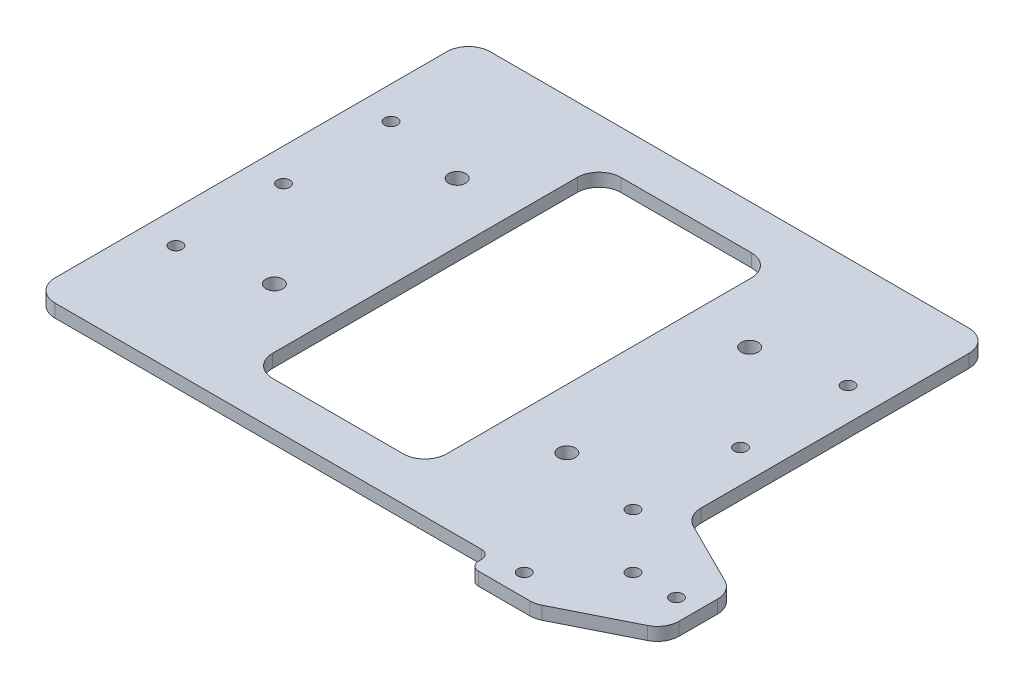
from build123d import *

# Parameters (mm, degrees)
SKETCH_1_R      = 1.95
SKETCH_1_R_2    = 1.45
SKETCH_1_W      = 40
SKETCH_1_H      = 80
EXTRUDE_1_DEPTH = 3
FILLET_1_R      = 5
FILLET_3_R      = 2


with BuildPart() as part:
    # 草图1 → 凸台-拉伸1 (new body)
    with BuildSketch(Plane(origin=(0, 0, 0), x_dir=(1, 0, 0), z_dir=(0, 1, 0))):
        Polygon((-60, -50), (-60, 50), (60, 50), (60, -19.7), (80, -29.7), (80, -44.7), (60, -54.7), (45, -54.7), (45, -50), align=None)
        with Locations(Location((-33.6, 21, 0), (0, 0, 270))):
            Circle(SKETCH_1_R, mode=Mode.SUBTRACT)
        with Locations(Location((-33.6, -21, 0), (0, 0, 90))):
            Circle(SKETCH_1_R, mode=Mode.SUBTRACT)
        with Locations(Location((33.6, -21, 0), (0, 0, 270))):
            Circle(SKETCH_1_R, mode=Mode.SUBTRACT)
        with Locations(Location((33.6, 21, 0), (0, 0, 90))):
            Circle(SKETCH_1_R, mode=Mode.SUBTRACT)
        with Locations(Location((65, -37.2, 0), (0, 0, 270))):
            Circle(SKETCH_1_R_2, mode=Mode.SUBTRACT)
        with Locations(Location((75, -37.2, 0), (0, 0, 270))):
            Circle(SKETCH_1_R_2, mode=Mode.SUBTRACT)
        with Locations(Location((52.5, -24.7, 0), (0, 0, 270))):
            Circle(SKETCH_1_R_2, mode=Mode.SUBTRACT)
        with Locations(Location((52.5, -49.7, 0), (0, 0, 270))):
            Circle(SKETCH_1_R_2, mode=Mode.SUBTRACT)
        with Locations(Location((52.5, 0, 0), (0, 0, 270))):
            Circle(SKETCH_1_R_2, mode=Mode.SUBTRACT)
        with Locations(Location((-52.5, 0, 0), (0, 0, 90))):
            Circle(SKETCH_1_R_2, mode=Mode.SUBTRACT)
        with Locations(Location((-52.5, -24.7, 0), (0, 0, 90))):
            Circle(SKETCH_1_R_2, mode=Mode.SUBTRACT)
        with Locations(Location((-52.5, 24.7, 0), (0, 0, 270))):
            Circle(SKETCH_1_R_2, mode=Mode.SUBTRACT)
        with Locations(Location((52.5, 24.7, 0), (0, 0, 90))):
            Circle(SKETCH_1_R_2, mode=Mode.SUBTRACT)
        Rectangle(SKETCH_1_W, SKETCH_1_H, mode=Mode.SUBTRACT)
    extrude(amount=EXTRUDE_1_DEPTH)

    # 圆角1
    fillet_1_edges = [part.edges().sort_by_distance(p)[0] for p in [
        (60, 1.5, 19.7),
        (80, 1.5, 29.7),
        (80, 1.5, 44.7),
        (60, 1.5, 54.7),
        (-60, 1.5, 50),
        (-60, 1.5, -50),
        (60, 1.5, -50),
        (20, 1.5, 40),
        (20, 1.5, -40),
        (-20, 1.5, -40),
        (-20, 1.5, 40),
    ]]
    fillet(fillet_1_edges, radius=FILLET_1_R)

    # 圆角3
    fillet_3_edges = [part.edges().sort_by_distance(p)[0] for p in [
        (45, 1.5, 54.7),
        (45, 1.5, 50),
    ]]
    fillet(fillet_3_edges, radius=FILLET_3_R)


solid = part.part
